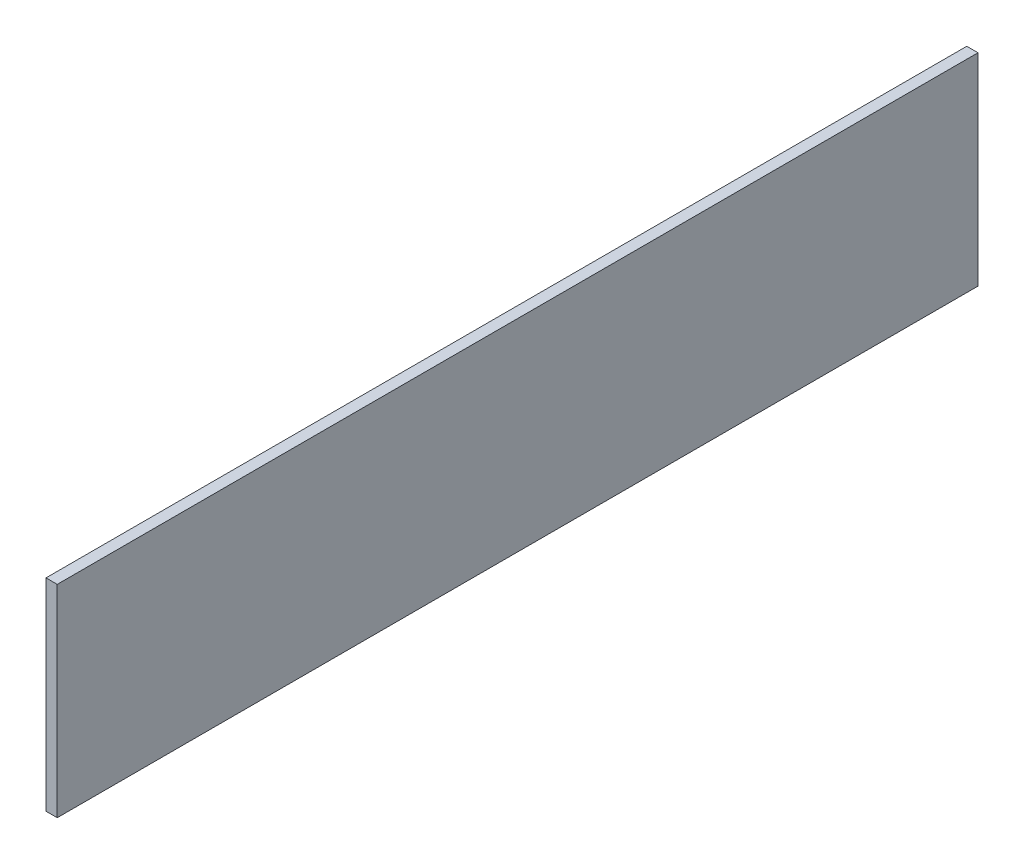
from build123d import *

# Parameters (mm, degrees)
SKETCH1_W           = 260.35
SKETCH1_H           = 57.15
BOSS_EXTRUDE1_DEPTH = 3.175


with BuildPart() as part:
    # Sketch1 → Boss-Extrude1 (new body)
    with BuildSketch(Plane(origin=(0, 0, 0), x_dir=(0, 0, -1), z_dir=(1, 0, 0))):
        with Locations((0, 28.575)):
            Rectangle(SKETCH1_W, SKETCH1_H)
    extrude(amount=BOSS_EXTRUDE1_DEPTH)


solid = part.part
